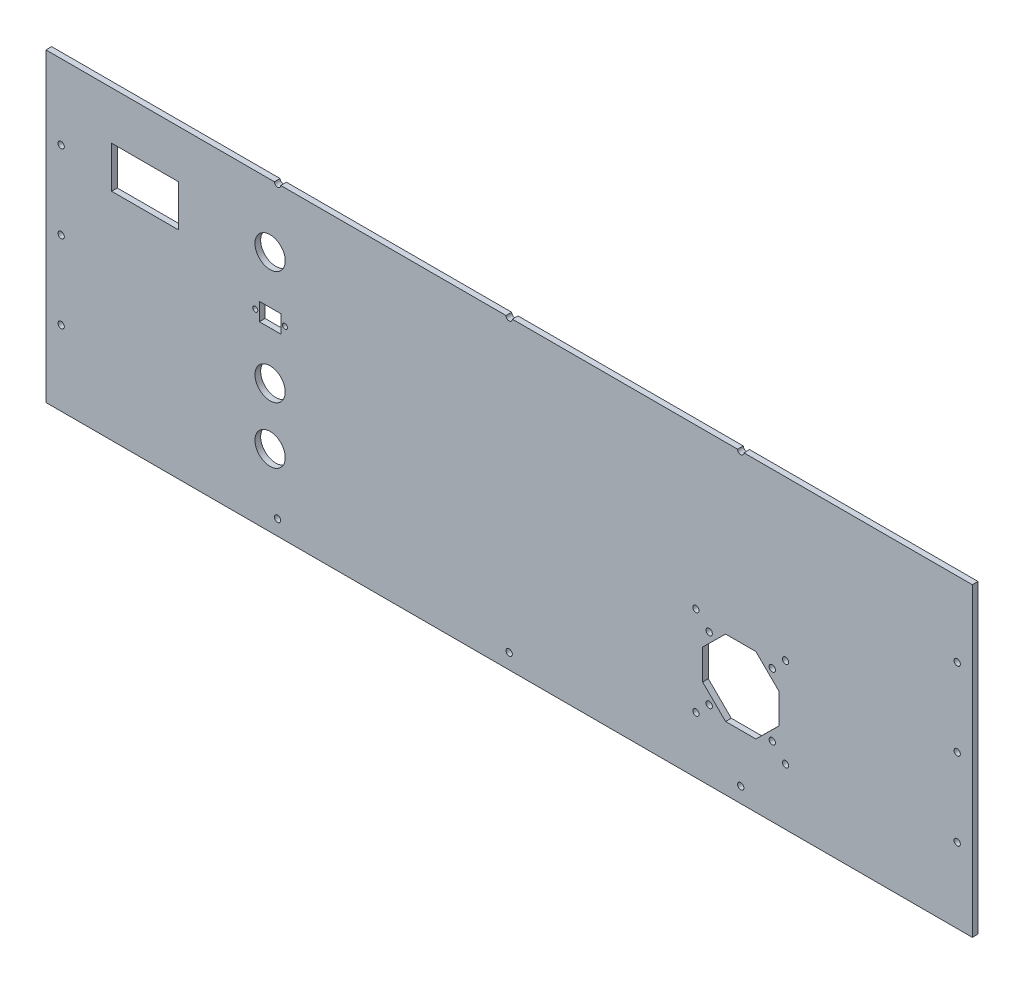
from build123d import *

# Parameters (mm, degrees)
SKETCH1_R           = 2.5
BOSS_EXTRUDE1_DEPTH = 4.5
SKETCH2_W           = 53
SKETCH2_H           = 33
SKETCH2_R           = 12
SKETCH2_R_2         = 2.5
CUT_EXTRUDE2_DEPTH  = 10
SKETCH2_6_R         = 2
SKETCH2_6_W         = 17
SKETCH2_6_H         = 14
CUT_EXTRUDE3_DEPTH  = 10


with BuildPart() as part:
    # Sketch1 → Boss-Extrude1 (new body)
    with BuildSketch(Plane.XY):
        with BuildLine():
            Line((-367, 123.5), (-186, 123.5))
            ThreePointArc((-186, 123.5), (-183.5, 121), (-181, 123.5))
            Line((-181, 123.5), (-2.5, 123.5))
            ThreePointArc((-2.5, 123.5), (0, 121), (2.5, 123.5))
            Line((2.5, 123.5), (181, 123.5))
            ThreePointArc((181, 123.5), (183.5, 121), (186, 123.5))
            Line((186, 123.5), (367, 123.5))
            Line((367, 123.5), (367, -118.5))
            Line((367, -118.5), (-367, -118.5))
            Line((-367, -118.5), (-367, 123.5))
        make_face()
        with Locations((-355, 2.5)):
            Circle(SKETCH1_R, mode=Mode.SUBTRACT)
        with Locations((-355, 64.25)):
            Circle(SKETCH1_R, mode=Mode.SUBTRACT)
        with Locations((-355, -59.25)):
            Circle(SKETCH1_R, mode=Mode.SUBTRACT)
        with Locations((355, -59.25)):
            Circle(SKETCH1_R, mode=Mode.SUBTRACT)
        with Locations((355, 2.5)):
            Circle(SKETCH1_R, mode=Mode.SUBTRACT)
        with Locations((355, 64.25)):
            Circle(SKETCH1_R, mode=Mode.SUBTRACT)
        with Locations((-183.5, -106.5)):
            Circle(SKETCH1_R, mode=Mode.SUBTRACT)
        with Locations((0, -106.5)):
            Circle(SKETCH1_R, mode=Mode.SUBTRACT)
        with Locations((183.5, -106.5)):
            Circle(SKETCH1_R, mode=Mode.SUBTRACT)
    extrude(amount=BOSS_EXTRUDE1_DEPTH)

    # Sketch2 → Cut-Extrude2 (cut)
    with BuildSketch(Plane.XY.offset(4.5)):
        with Locations((-288.5, 69)):
            Rectangle(SKETCH2_W, SKETCH2_H)
        with Locations((-189.425096945, 73.5)):
            Circle(SKETCH2_R)
        Polygon((195.5, -8.117912133), (171.5, -8.117912133), (153.306947094, -26.117912133), (153.306947094, -50.117912133), (171.5, -68.117912133), (195.5, -68.117912133), (213.693052906, -50.117912133), (213.693052906, -26.117912133), align=None)
        with Locations((-189.425096945, -16.5)):
            Circle(SKETCH2_R)
        with Locations((-189.425096945, -61.5)):
            Circle(SKETCH2_R)
        with Locations((208.5, -13.117912133)):
            Circle(SKETCH2_R_2)
        with Locations((208.5, -63.117912133)):
            Circle(SKETCH2_R_2)
        with Locations((158.5, -63.117912133)):
            Circle(SKETCH2_R_2)
        with Locations((158.5, -13.117912133)):
            Circle(SKETCH2_R_2)
        with Locations((219, -2.617912133)):
            Circle(SKETCH2_R_2)
        with Locations((219, -73.617912133)):
            Circle(SKETCH2_R_2)
        with Locations((148, -2.617912133)):
            Circle(SKETCH2_R_2)
        with Locations((148, -73.617912133)):
            Circle(SKETCH2_R_2)
    extrude(amount=-CUT_EXTRUDE2_DEPTH, mode=Mode.SUBTRACT)

    # Sketch2<6> → Cut-Extrude3 (cut)
    with BuildSketch(Plane.XY.offset(4.5)):
        with Locations((-201.185142567, 28.5)):
            Circle(SKETCH2_6_R)
        with Locations((-177.665051324, 28.5)):
            Circle(SKETCH2_6_R)
        with Locations((-189.425096945, 28.5)):
            Rectangle(SKETCH2_6_W, SKETCH2_6_H)
    extrude(amount=-CUT_EXTRUDE3_DEPTH, mode=Mode.SUBTRACT)


solid = part.part
